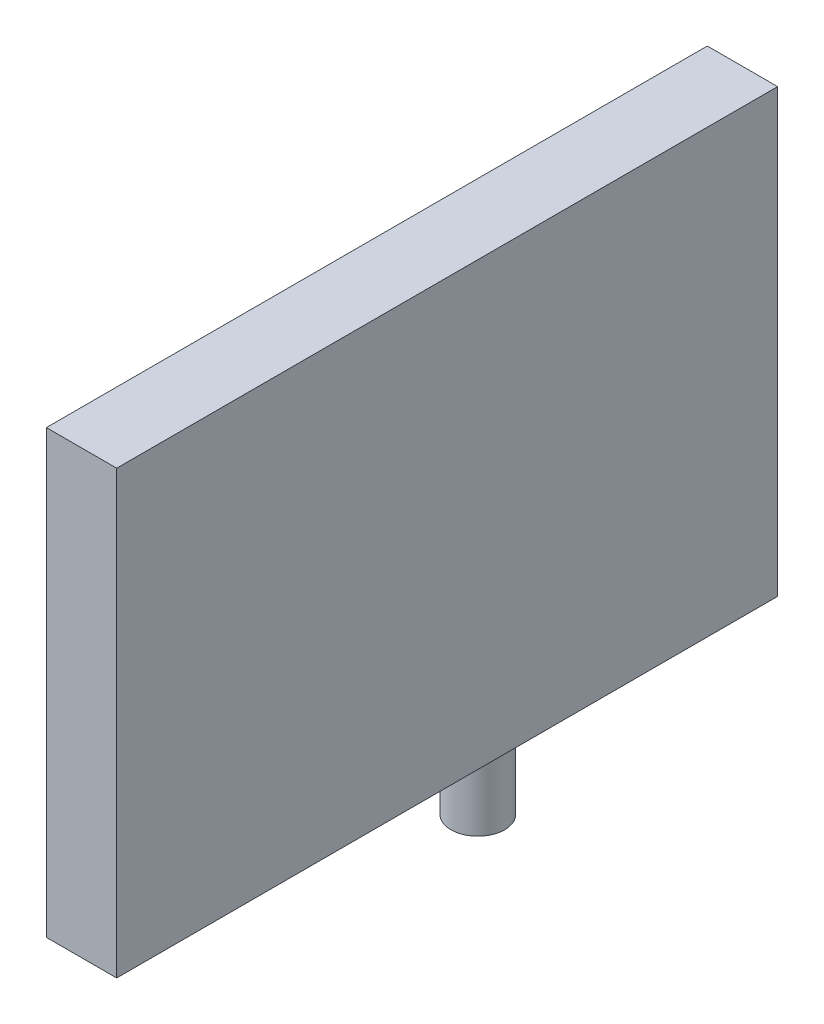
from build123d import *

# Parameters (mm, degrees)
SKETCH2_W           = 93.996020074
SKETCH2_H           = 62.791633466
BOSS_EXTRUDE1_DEPTH = 10
SKETCH3_R           = 3.811808022
BOSS_EXTRUDE2_DEPTH = 10


with BuildPart() as part:
    # Sketch2 → Boss-Extrude1 (new body)
    with BuildSketch(Plane(origin=(0, 0, 0), x_dir=(0, 0, -1), z_dir=(1, 0, 0))):
        Rectangle(SKETCH2_W, SKETCH2_H)
    extrude(amount=BOSS_EXTRUDE1_DEPTH)

    # Sketch3 → Boss-Extrude2 (add)
    with BuildSketch(Plane(origin=(0, -31.395816733, 0), x_dir=(-1, 0, 0), z_dir=(0, -1, 0))):
        with Locations(Location((-5.527088821, 8.834157346, 0), (0, 0, 270))):
            Circle(SKETCH3_R)
    extrude(amount=BOSS_EXTRUDE2_DEPTH)


solid = part.part
